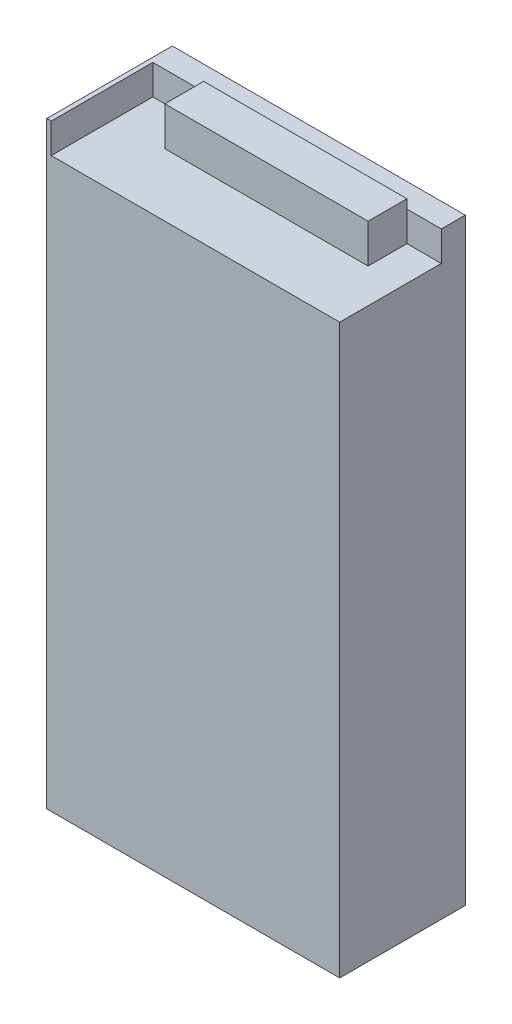
from build123d import *

# Parameters (mm, degrees)
SKETCH_1_W          = 98
SKETCH_1_H          = 200
EXTRUDE_1_DEPTH     = 42
SKETCH_2_R          = 1.5
CUT_EXTRUDE_3_DEPTH = 5
SKETCH_3_W          = 96.5
SKETCH_3_H          = 10
CUT_EXTRUDE_4_DEPTH = 34
SKETCH_4_W          = 68
SKETCH_4_H          = 13
EXTRUDE_2_DEPTH     = 13


with BuildPart() as part:
    # Эскиз1 → Бобышка-Вытянуть1 (new body)
    with BuildSketch(Plane.XY):
        with Locations((30.809352232, -67.603045404)):
            Rectangle(SKETCH_1_W, SKETCH_1_H)
    extrude(amount=EXTRUDE_1_DEPTH)

    # Эскиз2 → Вырез-Вытянуть3 (cut)
    with BuildSketch(Plane.XY):
        with Locations((-9.190647768, -30.103045404)):
            Circle(SKETCH_2_R)
        with Locations((70.809352232, -30.103045404)):
            Circle(SKETCH_2_R)
        with Locations((-9.190647768, -150.103045404)):
            Circle(SKETCH_2_R)
        with Locations((70.809352232, -150.103045404)):
            Circle(SKETCH_2_R)
    extrude(amount=CUT_EXTRUDE_3_DEPTH, mode=Mode.SUBTRACT)

    # Эскиз3 → Вырез-Вытянуть4 (cut)
    with BuildSketch(Plane.XY.offset(42)):
        with Locations((31.559352232, 27.396954596)):
            Rectangle(SKETCH_3_W, SKETCH_3_H)
    extrude(amount=-CUT_EXTRUDE_4_DEPTH, mode=Mode.SUBTRACT)

    # Эскиз4 → Бобышка-Вытянуть2 (add)
    with BuildSketch(Plane(origin=(0, 22.396954596, 0), x_dir=(1, 0, 0), z_dir=(0, 1, 0))):
        with Locations((34.309352232, -14.5)):
            Rectangle(SKETCH_4_W, SKETCH_4_H)
    extrude(amount=EXTRUDE_2_DEPTH)


solid = part.part
